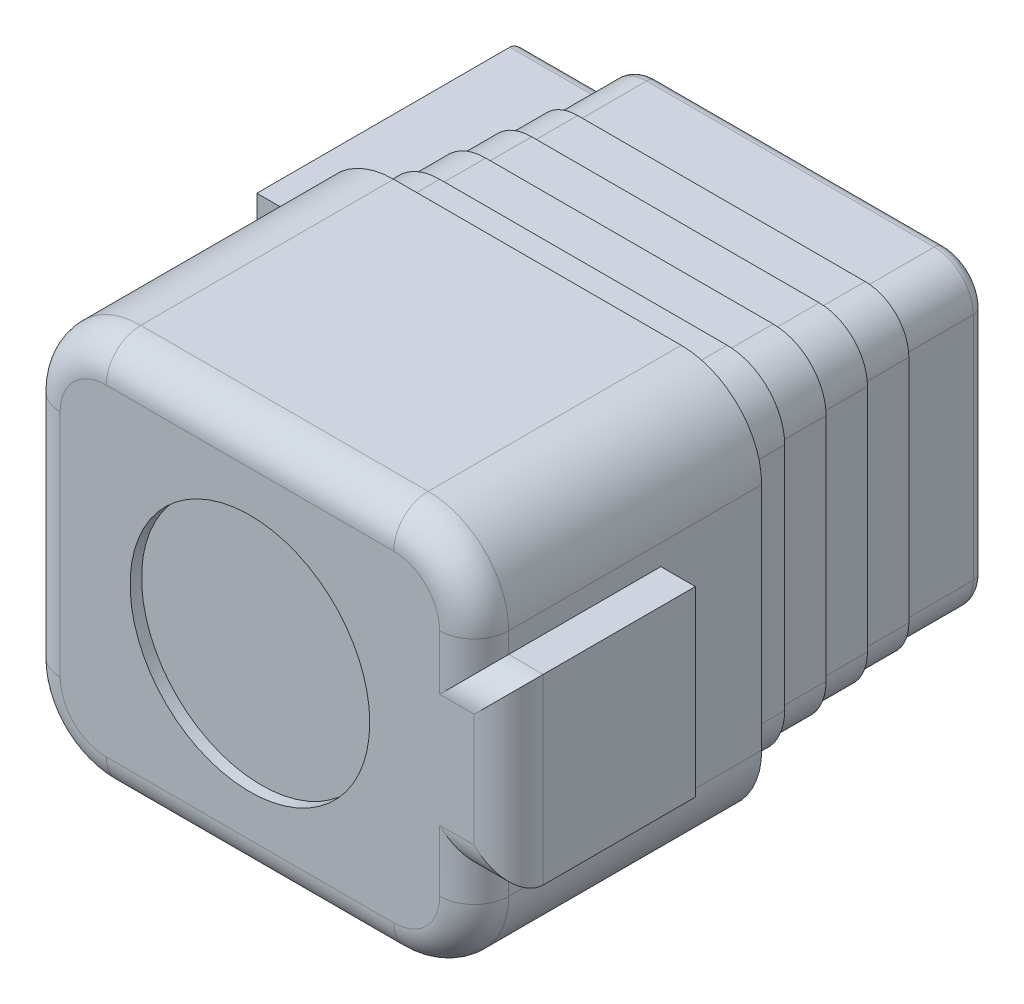
from build123d import *

# Parameters (mm, degrees)
EXTRUDE_1_DEPTH     = 25
EXTRUDE_3_DEPTH     = 4
EXTRUDE_4_DEPTH     = 4
EXTRUDE_5_DEPTH     = 4
EXTRUDE_6_DEPTH     = 4
EXTRUDE_7_DEPTH     = 7
SKETCH_7_W          = 23
SKETCH_7_H          = 20
EXTRUDE_8_DEPTH     = 8.5
SKETCH_8_W          = 16.231712275
SKETCH_8_H          = 15.860541866
EXTRUDE_9_DEPTH     = 3
FILLET_1_R          = 3
FILLET_2_R          = 1
SKETCH_9_R          = 10.42057087
CUT_EXTRUDE_1_DEPTH = 1
SKETCH_10_R         = 10.197555966
CUT_EXTRUDE_2_DEPTH = 1


with BuildPart() as part:
    # ｽｹｯﾁ1 → ﾎﾞｽ - 押し出し1 (new body)
    with BuildSketch(Plane.XY):
        with BuildLine():
            Line((7, 0), (32, 0))
            ThreePointArc((32, 0), (36.949747468, 2.050252532), (39, 7))
            Line((39, 7), (39, 27))
            ThreePointArc((39, 27), (36.949747468, 31.949747468), (32, 34))
            Line((32, 34), (7, 34))
            ThreePointArc((7, 34), (2.050252532, 31.949747468), (0, 27))
            Line((0, 27), (0, 7))
            ThreePointArc((0, 7), (2.050252532, 2.050252532), (7, 0))
        make_face()
    extrude(amount=EXTRUDE_1_DEPTH)

    # ｽｹｯﾁ2 → ﾎﾞｽ - 押し出し3 (add)
    with BuildSketch(Plane(origin=(0, 0, 0), x_dir=(-1, 0, 0), z_dir=(0, 0, -1))):
        with BuildLine():
            Line((-37, 27), (-37, 7))
            ThreePointArc((-37, 7), (-35.535533906, 3.464466094), (-32, 2))
            Line((-32, 2), (-7, 2))
            ThreePointArc((-7, 2), (-3.464466094, 3.464466094), (-2, 7))
            Line((-2, 7), (-2, 27))
            ThreePointArc((-2, 27), (-3.464466094, 30.535533906), (-7, 32))
            Line((-7, 32), (-32, 32))
            ThreePointArc((-32, 32), (-35.535533906, 30.535533906), (-37, 27))
        make_face()
    extrude(amount=EXTRUDE_3_DEPTH)

    # ｽｹｯﾁ3 → ﾎﾞｽ - 押し出し4 (add)
    with BuildSketch(Plane(origin=(0, 0, -4), x_dir=(-1, 0, 0), z_dir=(0, 0, -1))):
        with BuildLine():
            Line((-32, 2.4), (-7, 2.4))
            ThreePointArc((-7, 2.4), (-3.747308807, 3.747308807), (-2.4, 7))
            Line((-2.4, 7), (-2.4, 27))
            ThreePointArc((-2.4, 27), (-3.747308807, 30.252691193), (-7, 31.6))
            Line((-7, 31.6), (-32, 31.6))
            ThreePointArc((-32, 31.6), (-35.252691193, 30.252691193), (-36.6, 27))
            Line((-36.6, 27), (-36.6, 7))
            ThreePointArc((-36.6, 7), (-35.252691193, 3.747308807), (-32, 2.4))
        make_face()
    extrude(amount=EXTRUDE_4_DEPTH)

    # ｽｹｯﾁ4 → ﾎﾞｽ - 押し出し5 (add)
    with BuildSketch(Plane(origin=(0, 0, -8), x_dir=(-1, 0, 0), z_dir=(0, 0, -1))):
        with BuildLine():
            Line((-36.2, 27), (-36.2, 7))
            ThreePointArc((-36.2, 7), (-34.969848481, 4.030151519), (-32, 2.8))
            Line((-32, 2.8), (-7, 2.8))
            ThreePointArc((-7, 2.8), (-4.030151519, 4.030151519), (-2.8, 7))
            Line((-2.8, 7), (-2.8, 27))
            ThreePointArc((-2.8, 27), (-4.030151519, 29.969848481), (-7, 31.2))
            Line((-7, 31.2), (-32, 31.2))
            ThreePointArc((-32, 31.2), (-34.969848481, 29.969848481), (-36.2, 27))
        make_face()
    extrude(amount=EXTRUDE_5_DEPTH)

    # ｽｹｯﾁ5 → ﾎﾞｽ - 押し出し6 (add)
    with BuildSketch(Plane(origin=(0, 0, -12), x_dir=(-1, 0, 0), z_dir=(0, 0, -1))):
        with BuildLine():
            Line((-35.8, 27), (-35.8, 7))
            ThreePointArc((-35.8, 7), (-34.687005769, 4.312994231), (-32, 3.2))
            Line((-32, 3.2), (-7, 3.2))
            ThreePointArc((-7, 3.2), (-4.312994231, 4.312994231), (-3.2, 7))
            Line((-3.2, 7), (-3.2, 27))
            ThreePointArc((-3.2, 27), (-4.312994231, 29.687005769), (-7, 30.8))
            Line((-7, 30.8), (-32, 30.8))
            ThreePointArc((-32, 30.8), (-34.687005769, 29.687005769), (-35.8, 27))
        make_face()
    extrude(amount=EXTRUDE_6_DEPTH)

    # ｽｹｯﾁ6 → ﾎﾞｽ - 押し出し7 (add)
    with BuildSketch(Plane(origin=(0, 0, -16), x_dir=(-1, 0, 0), z_dir=(0, 0, -1))):
        with BuildLine():
            Line((-35.4, 27), (-35.4, 7))
            ThreePointArc((-35.4, 7), (-34.404163056, 4.595836944), (-32, 3.6))
            Line((-32, 3.6), (-7, 3.6))
            ThreePointArc((-7, 3.6), (-4.595836944, 4.595836944), (-3.6, 7))
            Line((-3.6, 7), (-3.6, 27))
            ThreePointArc((-3.6, 27), (-4.595836944, 29.404163056), (-7, 30.4))
            Line((-7, 30.4), (-32, 30.4))
            ThreePointArc((-32, 30.4), (-34.404163056, 29.404163056), (-35.4, 27))
        make_face()
    extrude(amount=EXTRUDE_7_DEPTH)

    # ｽｹｯﾁ7 → ﾎﾞｽ - 押し出し8 (add)
    with BuildSketch(Plane.ZY.offset(-3.6)):
        with Locations((-11.5, 17)):
            Rectangle(SKETCH_7_W, SKETCH_7_H)
    extrude(amount=EXTRUDE_8_DEPTH)

    # ｽｹｯﾁ8 → ﾎﾞｽ - 押し出し9 (add)
    with BuildSketch(Plane(origin=(39, 0, 0), x_dir=(0, 0, -1), z_dir=(1, 0, 0))):
        with Locations((-16.884143863, 17.283223962)):
            Rectangle(SKETCH_8_W, SKETCH_8_H)
    extrude(amount=EXTRUDE_9_DEPTH)

    # ﾌｨﾚｯﾄ1
    fillet_1_edges = [part.edges().sort_by_distance(p)[0] for p in [
        (39, 26.106747447, 25),
        (40.5, 25.213494895, 25),
        (42, 17.283223962, 25),
        (40.5, 9.352953029, 25),
        (39, 8.176476514, 25),
        (36.949747468, 2.050252532, 25),
        (19.5, 0, 25),
        (2.050252532, 2.050252532, 25),
        (0, 17, 25),
        (2.050252532, 31.949747468, 25),
        (19.5, 34, 25),
        (36.949747468, 31.949747468, 25),
    ]]
    fillet(fillet_1_edges, radius=FILLET_1_R)

    # ﾌｨﾚｯﾄ2
    fillet_2_edges = [part.edges().sort_by_distance(p)[0] for p in [
        (19.5, 30.4, -23),
        (4.595836944, 29.404163056, -23),
        (-0.65, 27, -23),
        (-4.9, 17, -23),
        (-0.65, 7, -23),
        (4.595836944, 4.595836944, -23),
        (19.5, 3.6, -23),
        (34.404163056, 4.595836944, -23),
        (35.4, 17, -23),
        (34.404163056, 29.404163056, -23),
    ]]
    fillet(fillet_2_edges, radius=FILLET_2_R)

    # ｽｹｯﾁ9 → ｶｯﾄ - 押し出し1 (cut)
    with BuildSketch(Plane.XY.offset(25)):
        with Locations((19.497752913, 17.033640908)):
            Circle(SKETCH_9_R)
    extrude(amount=-CUT_EXTRUDE_1_DEPTH, mode=Mode.SUBTRACT)

    # ｽｹｯﾁ10 → ｶｯﾄ - 押し出し2 (cut)
    with BuildSketch(Plane(origin=(0, 0, -23), x_dir=(-1, 0, 0), z_dir=(0, 0, -1))):
        with Locations((-19.633872533, 17.026501787)):
            Circle(SKETCH_10_R)
    extrude(amount=-CUT_EXTRUDE_2_DEPTH, mode=Mode.SUBTRACT)


solid = part.part
